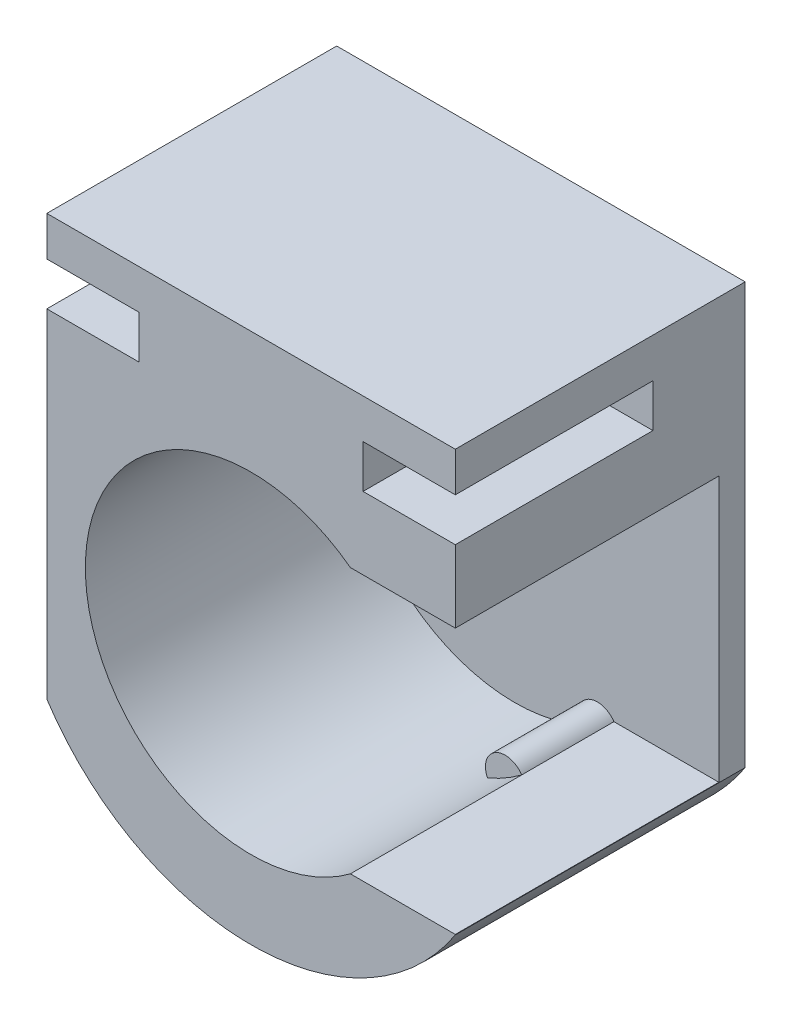
from build123d import *
from build123d.topology import SkipClean

# Parameters (mm, degrees)
SKETCH1_R           = 12.575
BOSS_EXTRUDE1_DEPTH = 15
BOSS_EXTRUDE2_START = 7
SKETCH2_R           = 12.575
BOSS_EXTRUDE2_DEPTH = 7
SKETCH3_R           = 12.575
BOSS_EXTRUDE3_DEPTH = 2
BOSS_EXTRUDE4_DEPTH = 22
SKETCH5_W           = 3.1
SKETCH5_H           = 3.1
CUT_EXTRUDE1_DEPTH  = 5.1
SKETCH7_R           = 1.5
BOSS_EXTRUDE5_DEPTH = 7
CUT_EXTRUDE2_START  = -20
CUT_EXTRUDE2_DEPTH  = 20


with BuildPart() as part:
    # Sketch1 → Boss-Extrude1 (new body)
    with BuildSketch(Plane.XY):
        with BuildLine():
            ThreePointArc((-15.5, 0), (0, -15.5), (15.5, 0))
            Line((15.5, 0), (15.5, 15.55))
            Line((15.5, 15.55), (8.5, 15.55))
            Line((8.5, 15.55), (8.5, 18.825))
            Line((8.5, 18.825), (15.5, 18.825))
            Line((15.5, 18.825), (15.5, 21.825))
            Line((15.5, 21.825), (-15.5, 21.825))
            Line((-15.5, 21.825), (-15.5, 18.825))
            Line((-15.5, 18.825), (-8.5, 18.825))
            Line((-8.5, 18.825), (-8.5, 15.55))
            Line((-8.5, 15.55), (-15.5, 15.55))
            Line((-15.5, 15.55), (-15.5, 0))
        make_face()
        Circle(SKETCH1_R, mode=Mode.SUBTRACT)
    extrude(amount=BOSS_EXTRUDE1_DEPTH)

    # Sketch2 → Boss-Extrude2 (add)
    with SkipClean():  # the faces are left unmerged after this step: merging them gives an invalid solid
        with BuildSketch(Plane(origin=(0, 0, 0), x_dir=(-1, 0, 0), z_dir=(0, 0, -1)).offset(BOSS_EXTRUDE2_START)):
            with BuildLine():
                ThreePointArc((-15.5, 0), (0, -15.5), (15.5, 0))
                Line((15.5, 0), (15.5, 21.825))
                Line((15.5, 21.825), (-15.5, 21.825))
                Line((-15.5, 21.825), (-15.5, 0))
            make_face()
            Circle(SKETCH2_R, mode=Mode.SUBTRACT)
        extrude(amount=-BOSS_EXTRUDE2_DEPTH)

    # Sketch3 → Boss-Extrude3 (add)
    with SkipClean():  # the faces are left unmerged after this step: merging them gives an invalid solid
        with BuildSketch(Plane(origin=(0, 0, -7), x_dir=(-1, 0, 0), z_dir=(0, 0, -1))):
            Circle(SKETCH3_R)
        extrude(amount=-BOSS_EXTRUDE3_DEPTH)

    # Sketch4 → Boss-Extrude4 (add)
    with SkipClean():  # the faces are left unmerged after this step: merging them gives an invalid solid
        with BuildSketch(Plane(origin=(0, 0, -7), x_dir=(-1, 0, 0), z_dir=(0, 0, -1))):
            with BuildLine():
                Line((15.5, -10.099504938), (15.5, 0))
                ThreePointArc((15.5, 0), (0, -15.5), (-15.5, 0))
                Line((-15.5, 0), (-15.5, -10.099504938))
                ThreePointArc((-15.5, -10.099504938), (0, -18.5), (15.5, -10.099504938))
            make_face()
        extrude(amount=-BOSS_EXTRUDE4_DEPTH)

    # Sketch5 → Cut-Extrude1 (cut)
    with SkipClean():  # the faces are left unmerged after this step: merging them gives an invalid solid
        with BuildSketch(Plane(origin=(0, 0, -7), x_dir=(-1, 0, 0), z_dir=(0, 0, -1))):
            with Locations((0, -16.95)):
                Rectangle(SKETCH5_W, SKETCH5_H)
        extrude(amount=-CUT_EXTRUDE1_DEPTH, mode=Mode.SUBTRACT)

    # Sketch7 → Boss-Extrude5 (add)
    with SkipClean():  # the faces are left unmerged after this step: merging them gives an invalid solid
        with BuildSketch(Plane.XY.offset(-5)):
            with Locations((6.2875, 10.890269453)):
                Circle(SKETCH7_R)
            with Locations((6.2875, -10.890269453)):
                Circle(SKETCH7_R)
        extrude(amount=BOSS_EXTRUDE5_DEPTH)

    # Sketch6 → Cut-Extrude2 (cut)
    with BuildSketch(Plane.XY.offset(15).offset(CUT_EXTRUDE2_START)):
        with BuildLine():
            ThreePointArc((12.575, 0), (11.245882841, -5.626788082), (7.539493977, -10.064127164))
            Line((7.539493977, -10.064127164), (15.5, -10.064127164))
            Line((15.5, -10.064127164), (15.5, 10.064127164))
            Line((15.5, 10.064127164), (7.539493977, 10.064127164))
            ThreePointArc((7.539493977, 10.064127164), (11.245882841, 5.626788082), (12.575, 0))
        make_face()
    extrude(amount=CUT_EXTRUDE2_DEPTH, mode=Mode.SUBTRACT)


solid = part.part
